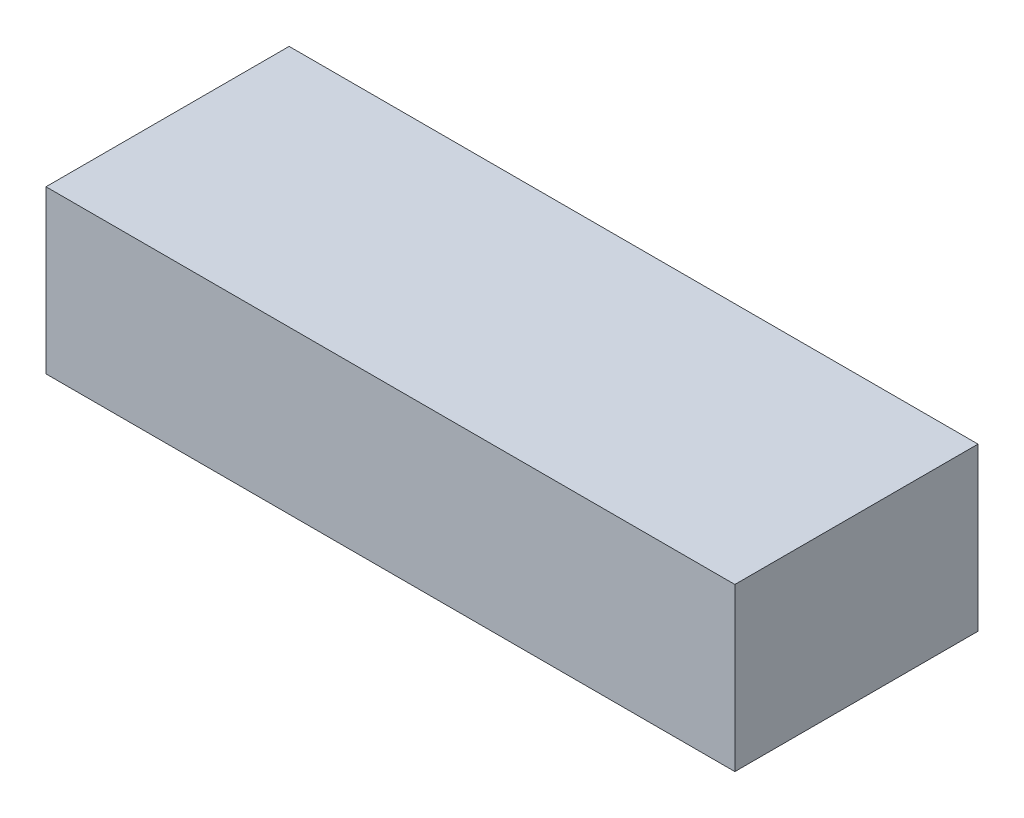
from build123d import *

# Parameters (mm, degrees)
CROQUIS1_W              = 68
CROQUIS1_H              = 24
SALIENTE_EXTRUIR1_DEPTH = 16


with BuildPart() as part:
    # Croquis1 → Saliente-Extruir1 (new body)
    with BuildSketch(Plane(origin=(0, 0, 0), x_dir=(1, 0, 0), z_dir=(0, 1, 0))):
        Rectangle(CROQUIS1_W, CROQUIS1_H)
    extrude(amount=SALIENTE_EXTRUIR1_DEPTH)


solid = part.part
